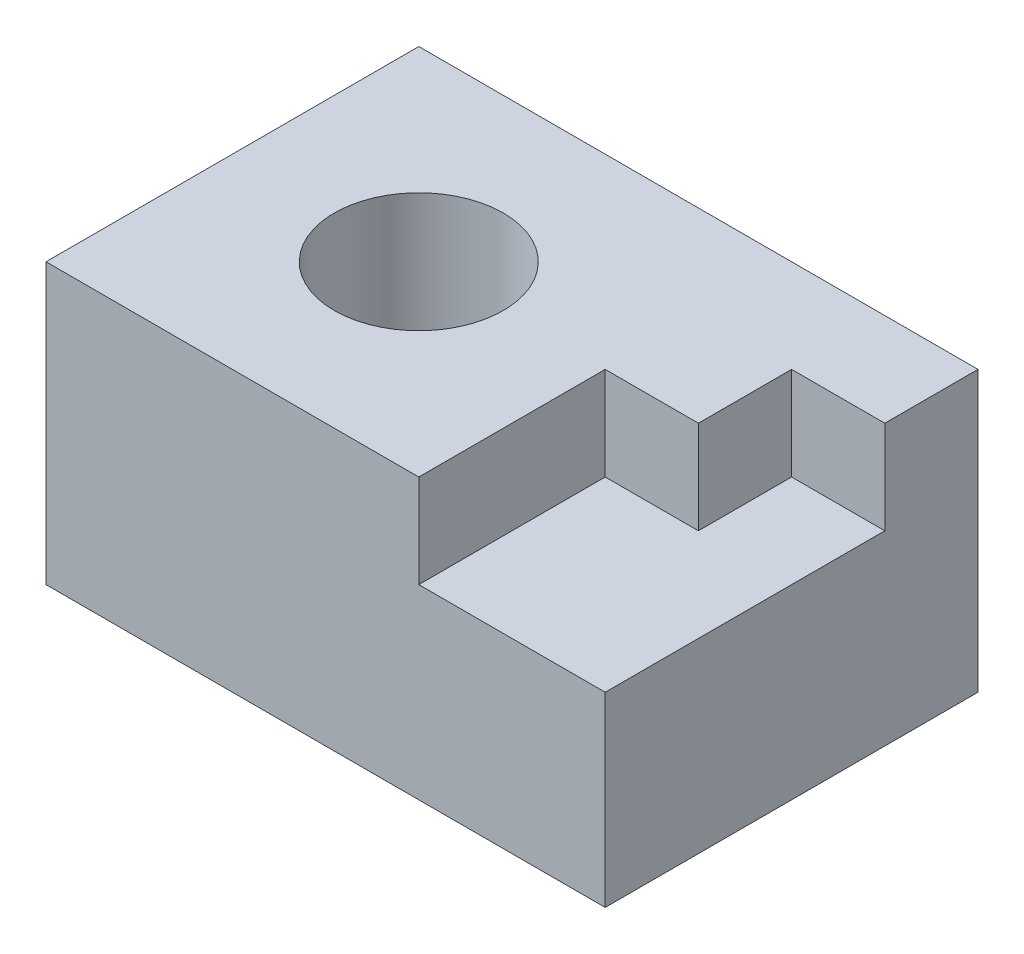
from build123d import *

# Parameters (mm, degrees)
SKETCH1_W           = 152.4
SKETCH1_H           = 101.6
BOSS_EXTRUDE1_DEPTH = 76.2
CUT_EXTRUDE1_DEPTH  = 25.4
SKETCH3_R           = 23.033719166
CUT_EXTRUDE2_DEPTH  = 120.1365603


with BuildPart() as part:
    # Sketch1 → Boss-Extrude1 (new body)
    with BuildSketch(Plane(origin=(0, 0, 0), x_dir=(1, 0, 0), z_dir=(0, 1, 0))):
        Rectangle(SKETCH1_W, SKETCH1_H)
    extrude(amount=BOSS_EXTRUDE1_DEPTH)

    # Sketch2 → Cut-Extrude1 (cut)
    with BuildSketch(Plane(origin=(0, 76.2, 0), x_dir=(1, 0, 0), z_dir=(0, 1, 0))):
        Polygon((76.2, -50.8), (25.4, -50.8), (25.4, 0), (50.8, 0), (50.8, 25.4), (76.2, 25.4), (76.2, 15.210104037), align=None)
    extrude(amount=-CUT_EXTRUDE1_DEPTH, mode=Mode.SUBTRACT)

    # Sketch3 → Cut-Extrude2 (cut, through all)
    with BuildSketch(Plane(origin=(0, 76.2, 0), x_dir=(1, 0, 0), z_dir=(0, 1, 0))):
        with Locations(Location((-25.4, 0, 0), (0, 0, 270))):
            Circle(SKETCH3_R)
    extrude(amount=-CUT_EXTRUDE2_DEPTH, mode=Mode.SUBTRACT)


solid = part.part
